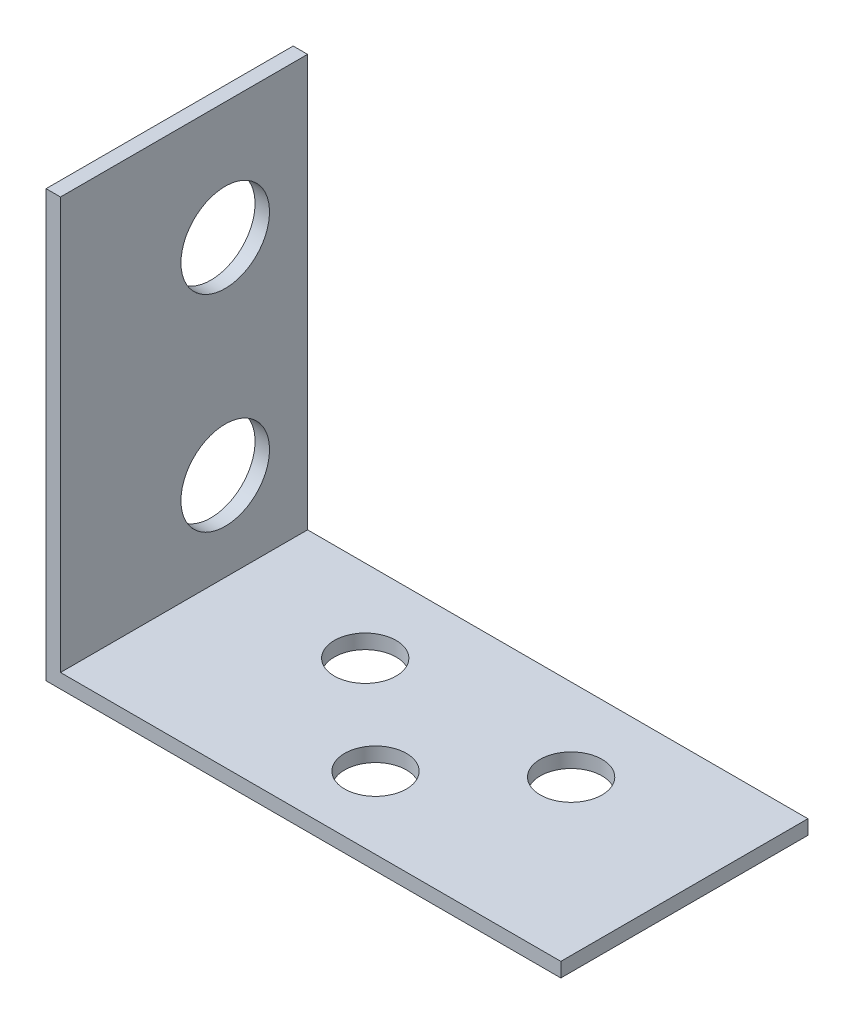
from build123d import *

# Parameters (mm, degrees)
SKETCH1_W           = 25
SKETCH1_H           = 12
SKETCH1_R           = 1.5
BOSS_EXTRUDE1_DEPTH = 0.7
SKETCH3_W           = 0.7
SKETCH3_H           = 12
BOSS_EXTRUDE3_DEPTH = 20
SKETCH4_R           = 2.15
CUT_EXTRUDE1_DEPTH  = 35.604768458


with BuildPart() as part:
    # Sketch1 → Boss-Extrude1 (new body)
    with BuildSketch(Plane(origin=(0, 0, 0), x_dir=(1, 0, 0), z_dir=(0, 1, 0))):
        with Locations((0, 6)):
            Rectangle(SKETCH1_W, SKETCH1_H)
        with Locations(Location((-5, 8, 0), (0, 0, 270))):
            Circle(SKETCH1_R, mode=Mode.SUBTRACT)
        with Locations(Location((5, 8, 0), (0, 0, 270))):
            Circle(SKETCH1_R, mode=Mode.SUBTRACT)
        with Locations(Location((0, 3.5, 0), (0, 0, 270))):
            Circle(SKETCH1_R, mode=Mode.SUBTRACT)
    extrude(amount=BOSS_EXTRUDE1_DEPTH)

    # Sketch3 → Boss-Extrude3 (add)
    with BuildSketch(Plane(origin=(0, 0.7, 0), x_dir=(1, 0, 0), z_dir=(0, 1, 0))):
        with Locations((-12.15, 6)):
            Rectangle(SKETCH3_W, SKETCH3_H)
    extrude(amount=BOSS_EXTRUDE3_DEPTH)

    # Sketch4 → Cut-Extrude1 (cut, through all)
    with BuildSketch(Plane.ZY.offset(12.5)):
        with Locations((-8, 5)):
            Circle(SKETCH4_R)
        with Locations((-8, 15)):
            Circle(SKETCH4_R)
    extrude(amount=-CUT_EXTRUDE1_DEPTH, mode=Mode.SUBTRACT)


solid = part.part
